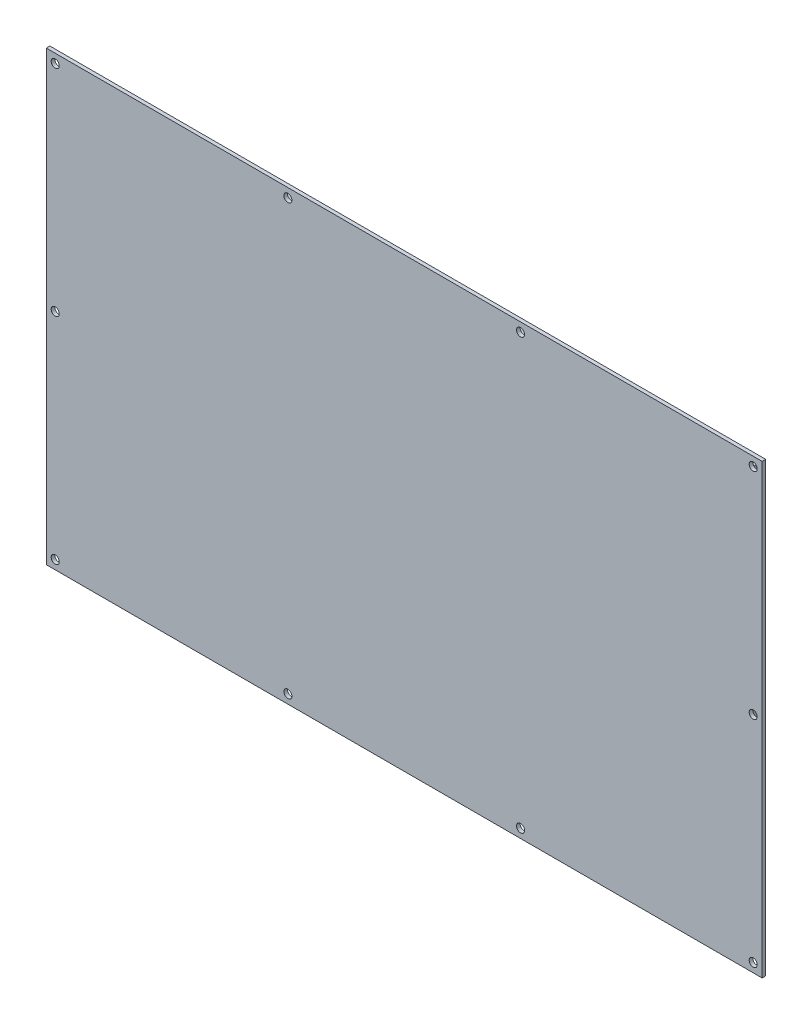
from build123d import *

# Parameters (mm, degrees)
IZIM1_W                     = 400
IZIM1_H                     = 250
Y_KSEKLIK_EKSTR_ZYON1_DEPTH = 2
KES_EKSTR_ZYON1_REACH       = 237.858
IZIM3_R                     = 2.25
IZIM4_W                     = 380
IZIM4_H                     = 230
Y_KSEKLIK_EKSTR_ZYON2_DEPTH = 6


with BuildPart() as part:
    # Çizim1 → Yükseklik-Ekstrüzyon1 (new body)
    with BuildSketch(Plane.XY):
        Rectangle(IZIM1_W, IZIM1_H)
    extrude(amount=Y_KSEKLIK_EKSTR_ZYON1_DEPTH)

    # Çizim3 → Kes-Ekstrüzyon1 (cut, up to next)
    with BuildSketch(Plane.XY.offset(2), mode=Mode.PRIVATE) as kes_ekstr_zyon1_sk1:
        with Locations((-195, 120)):
            Circle(IZIM3_R)
    kes_ekstr_zyon1_tool1 = extrude(kes_ekstr_zyon1_sk1.sketch, amount=-KES_EKSTR_ZYON1_REACH, mode=Mode.PRIVATE) & part.part
    # Çizim3 → Kes-Ekstrüzyon1 (cut, up to next)
    with BuildSketch(Plane.XY.offset(2), mode=Mode.PRIVATE) as kes_ekstr_zyon1_sk2:
        with Locations((-65, 120)):
            Circle(IZIM3_R)
    kes_ekstr_zyon1_tool2 = extrude(kes_ekstr_zyon1_sk2.sketch, amount=-KES_EKSTR_ZYON1_REACH, mode=Mode.PRIVATE) & part.part
    # Çizim3 → Kes-Ekstrüzyon1 (cut, up to next)
    with BuildSketch(Plane.XY.offset(2), mode=Mode.PRIVATE) as kes_ekstr_zyon1_sk3:
        with Locations((65, 120)):
            Circle(IZIM3_R)
    kes_ekstr_zyon1_tool3 = extrude(kes_ekstr_zyon1_sk3.sketch, amount=-KES_EKSTR_ZYON1_REACH, mode=Mode.PRIVATE) & part.part
    # Çizim3 → Kes-Ekstrüzyon1 (cut, up to next)
    with BuildSketch(Plane.XY.offset(2), mode=Mode.PRIVATE) as kes_ekstr_zyon1_sk4:
        with Locations((195, 120)):
            Circle(IZIM3_R)
    kes_ekstr_zyon1_tool4 = extrude(kes_ekstr_zyon1_sk4.sketch, amount=-KES_EKSTR_ZYON1_REACH, mode=Mode.PRIVATE) & part.part
    # Çizim3 → Kes-Ekstrüzyon1 (cut, up to next)
    with BuildSketch(Plane.XY.offset(2), mode=Mode.PRIVATE) as kes_ekstr_zyon1_sk5:
        with Locations(Location((-65, -120, 0), (0, 0, 180))):
            Circle(IZIM3_R)
    kes_ekstr_zyon1_tool5 = extrude(kes_ekstr_zyon1_sk5.sketch, amount=-KES_EKSTR_ZYON1_REACH, mode=Mode.PRIVATE) & part.part
    # Çizim3 → Kes-Ekstrüzyon1 (cut, up to next)
    with BuildSketch(Plane.XY.offset(2), mode=Mode.PRIVATE) as kes_ekstr_zyon1_sk6:
        with Locations(Location((65, -120, 0), (0, 0, 180))):
            Circle(IZIM3_R)
    kes_ekstr_zyon1_tool6 = extrude(kes_ekstr_zyon1_sk6.sketch, amount=-KES_EKSTR_ZYON1_REACH, mode=Mode.PRIVATE) & part.part
    # Çizim3 → Kes-Ekstrüzyon1 (cut, up to next)
    with BuildSketch(Plane.XY.offset(2), mode=Mode.PRIVATE) as kes_ekstr_zyon1_sk7:
        with Locations(Location((195, -120, 0), (0, 0, 180))):
            Circle(IZIM3_R)
    kes_ekstr_zyon1_tool7 = extrude(kes_ekstr_zyon1_sk7.sketch, amount=-KES_EKSTR_ZYON1_REACH, mode=Mode.PRIVATE) & part.part
    # Çizim3 → Kes-Ekstrüzyon1 (cut, up to next)
    with BuildSketch(Plane.XY.offset(2), mode=Mode.PRIVATE) as kes_ekstr_zyon1_sk8:
        with Locations(Location((-195, -120, 0), (0, 0, 180))):
            Circle(IZIM3_R)
    kes_ekstr_zyon1_tool8 = extrude(kes_ekstr_zyon1_sk8.sketch, amount=-KES_EKSTR_ZYON1_REACH, mode=Mode.PRIVATE) & part.part
    # Çizim3 → Kes-Ekstrüzyon1 (cut, up to next)
    with BuildSketch(Plane.XY.offset(2), mode=Mode.PRIVATE) as kes_ekstr_zyon1_sk9:
        with Locations(Location((-195, 0, 0), (0, 0, 180))):
            Circle(IZIM3_R)
    kes_ekstr_zyon1_tool9 = extrude(kes_ekstr_zyon1_sk9.sketch, amount=-KES_EKSTR_ZYON1_REACH, mode=Mode.PRIVATE) & part.part
    # Çizim3 → Kes-Ekstrüzyon1 (cut, up to next)
    with BuildSketch(Plane.XY.offset(2), mode=Mode.PRIVATE) as kes_ekstr_zyon1_sk10:
        with Locations(Location((195, 0, 0), (0, 0, 180))):
            Circle(IZIM3_R)
    kes_ekstr_zyon1_tool10 = extrude(kes_ekstr_zyon1_sk10.sketch, amount=-KES_EKSTR_ZYON1_REACH, mode=Mode.PRIVATE) & part.part
    add(kes_ekstr_zyon1_tool1.solids().sort_by_distance((-195, 120, 2))[0], mode=Mode.SUBTRACT)
    add(kes_ekstr_zyon1_tool2.solids().sort_by_distance((-65, 120, 2))[0], mode=Mode.SUBTRACT)
    add(kes_ekstr_zyon1_tool3.solids().sort_by_distance((65, 120, 2))[0], mode=Mode.SUBTRACT)
    add(kes_ekstr_zyon1_tool4.solids().sort_by_distance((195, 120, 2))[0], mode=Mode.SUBTRACT)
    add(kes_ekstr_zyon1_tool5.solids().sort_by_distance((-65, -120, 2))[0], mode=Mode.SUBTRACT)
    add(kes_ekstr_zyon1_tool6.solids().sort_by_distance((65, -120, 2))[0], mode=Mode.SUBTRACT)
    add(kes_ekstr_zyon1_tool7.solids().sort_by_distance((195, -120, 2))[0], mode=Mode.SUBTRACT)
    add(kes_ekstr_zyon1_tool8.solids().sort_by_distance((-195, -120, 2))[0], mode=Mode.SUBTRACT)
    add(kes_ekstr_zyon1_tool9.solids().sort_by_distance((-195, 0, 2))[0], mode=Mode.SUBTRACT)
    add(kes_ekstr_zyon1_tool10.solids().sort_by_distance((195, 0, 2))[0], mode=Mode.SUBTRACT)

    # Çizim4 → Yükseklik-Ekstrüzyon2 (add)
    with BuildSketch(Plane(origin=(0, 0, 0), x_dir=(-1, 0, 0), z_dir=(0, 0, -1))):
        Rectangle(IZIM4_W, IZIM4_H)
    extrude(amount=Y_KSEKLIK_EKSTR_ZYON2_DEPTH)


solid = part.part
